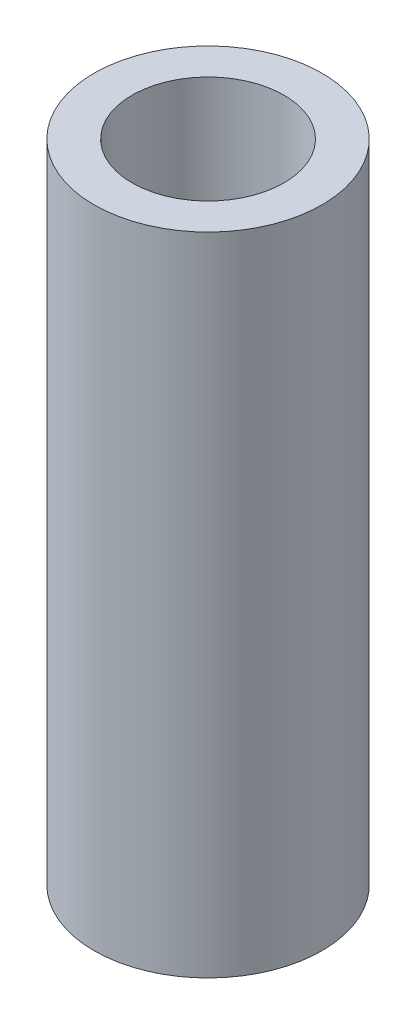
from build123d import *

# Parameters (mm, degrees)
SKETCH_1_R      = 7.5
SKETCH_1_R_2    = 5
EXTRUDE_1_DEPTH = 42.5


with BuildPart() as part:
    # 草图1 → 凸台-拉伸1 (new body)
    with BuildSketch(Plane(origin=(0, 0, 0), x_dir=(1, 0, 0), z_dir=(0, 1, 0))):
        with Locations(Location((0, 0, 0), (0, 0, 270))):
            Circle(SKETCH_1_R)
        with Locations(Location((0, 0, 0), (0, 0, 270))):
            Circle(SKETCH_1_R_2, mode=Mode.SUBTRACT)
    extrude(amount=EXTRUDE_1_DEPTH)


solid = part.part
